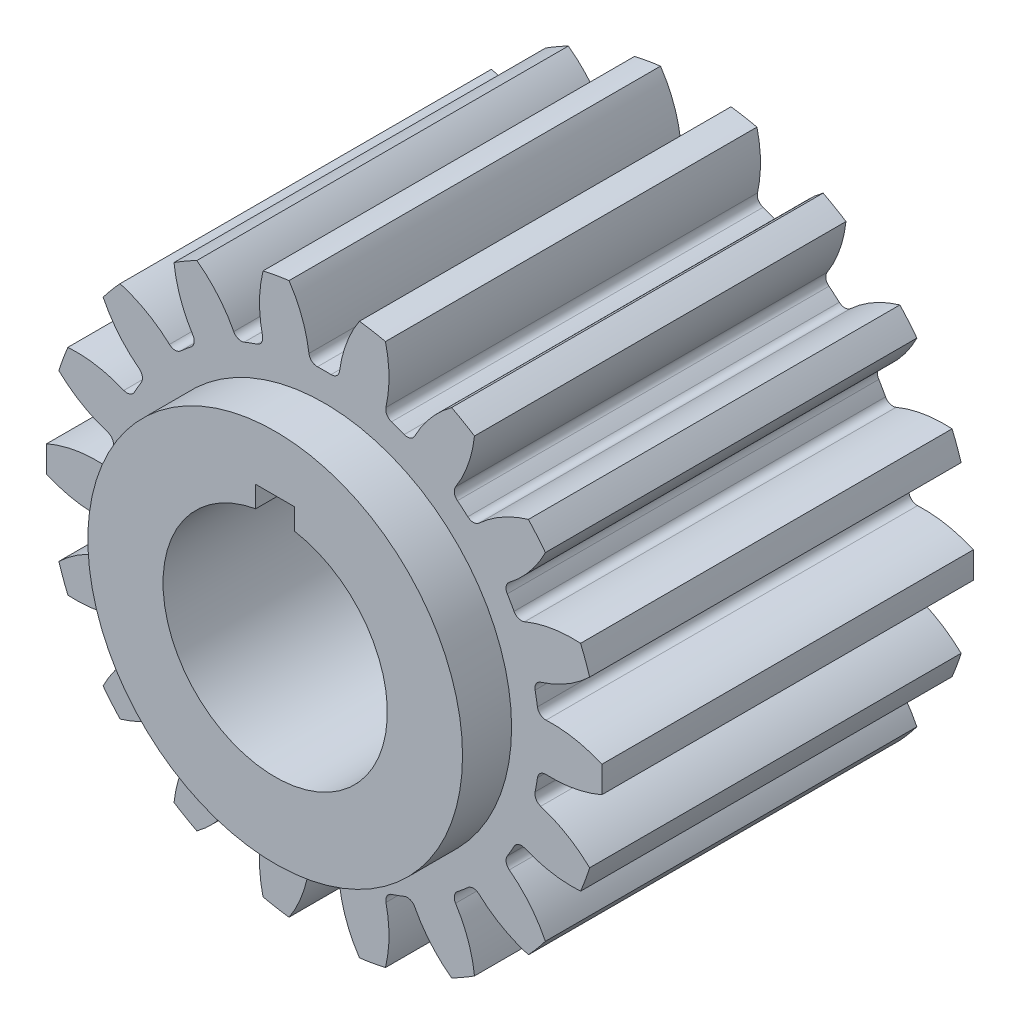
from build123d import *

# Parameters (mm, degrees)
SKETCH1_R                = 19.824032773
BOSS_EXTRUDE1_DEPTH      = 13.25
CUT_EXTRUDE1_DEPTH       = 39.577643147
FILLET1_R                = 0.594720983
CIRPATTERN2_COUNT        = 18
FILLET1_OF_CIRPATTERN2_R = 0.594720983
CUT_EXTRUDE2_DEPTH       = 39.495823844
BOSS_EXTRUDE3_START      = 3.5
SKETCH4_R                = 13.363625399
BOSS_EXTRUDE3_DEPTH      = 3.5


with BuildPart() as part:
    # Sketch1 → Boss-Extrude1 (new, symmetric)
    with BuildSketch(Plane.XY):
        Circle(SKETCH1_R)
    extrude(amount=BOSS_EXTRUDE1_DEPTH, both=True)

    # Sketch2 → Cut-Extrude1 (cut, through all)
    with BuildSketch(Plane.XY.offset(13.25)):
        with BuildLine():
            ThreePointArc((-3.206596484, 20.57566718), (-1.693168203, 18.129454416), (-1.03805801, 15.328516594))
            ThreePointArc((-1.03805801, 15.328516594), (0, 15.363625399), (1.03805801, 15.328516594))
            ThreePointArc((1.03805801, 15.328516594), (1.693168203, 18.129454416), (3.206596484, 20.57566718))
            ThreePointArc((3.206596484, 20.57566718), (0, 20.824032773), (-3.206596484, 20.57566718))
        make_face()
    cut_extrude1 = extrude(amount=-CUT_EXTRUDE1_DEPTH, mode=Mode.SUBTRACT)

    # Fillet1
    fillet1_edges = [part.edges().sort_by_distance(p)[0] for p in [
        (-1.03805801, 15.328516594, 0),
        (1.03805801, 15.328516594, 0),
    ]]
    fillet(fillet1_edges, radius=FILLET1_R)

    # CirPattern2: Cut-Extrude1 ×18 about axis
    cirpattern2_axis = Axis((0, 0, 0), (0, 0, 1))
    for i in range(1, CIRPATTERN2_COUNT):
        add(cut_extrude1.rotate(cirpattern2_axis, i * 360 / CIRPATTERN2_COUNT), mode=Mode.SUBTRACT)

    # Fillet1 of CirPattern2
    fillet1_of_cirpattern2_edges = [part.edges().sort_by_distance(p)[0] for p in [
        (-6.218116894, 14.049057182, 0),
        (-4.267205991, 14.75913068, 0),
        (-10.648179112, 11.075074131, 0),
        (-9.057781971, 12.409575785, 0),
        (-13.793913778, 6.76527369, 0),
        (-12.755855768, 8.563242904, 0),
        (-15.275898866, 1.639481397, 0),
        (-14.915385102, 3.684056549, 0),
        (-14.915385102, -3.684056549, 0),
        (-15.275898866, -1.639481397, 0),
        (-12.755855768, -8.563242904, 0),
        (-13.793913778, -6.76527369, 0),
        (-9.057781971, -12.409575785, 0),
        (-10.648179112, -11.075074131, 0),
        (-4.267205991, -14.75913068, 0),
        (-6.218116894, -14.049057182, 0),
        (1.03805801, -15.328516594, 0),
        (-1.03805801, -15.328516594, 0),
        (6.218116894, -14.049057182, 0),
        (4.267205991, -14.75913068, 0),
        (10.648179112, -11.075074131, 0),
        (9.057781971, -12.409575785, 0),
        (13.793913778, -6.76527369, 0),
        (12.755855768, -8.563242904, 0),
        (15.275898866, -1.639481397, 0),
        (14.915385102, -3.684056549, 0),
        (14.915385102, 3.684056549, 0),
        (15.275898866, 1.639481397, 0),
        (12.755855768, 8.563242904, 0),
        (13.793913778, 6.76527369, 0),
        (9.057781971, 12.409575785, 0),
        (10.648179112, 11.075074131, 0),
        (4.267205991, 14.75913068, 0),
        (6.218116894, 14.049057182, 0),
    ]]
    fillet(fillet1_of_cirpattern2_edges, radius=FILLET1_OF_CIRPATTERN2_R)

    # Sketch3 → Cut-Extrude2 (cut, through all)
    with BuildSketch(Plane.XY.offset(13.25)):
        with BuildLine():
            Line((-1.39, 7.878318348), (-1.39, 9.39))
            Line((-1.39, 9.39), (1.39, 9.39))
            Line((1.39, 9.39), (1.39, 7.878318348))
            ThreePointArc((1.39, 7.878318348), (0, -8), (-1.39, 7.878318348))
        make_face()
    extrude(amount=-CUT_EXTRUDE2_DEPTH, mode=Mode.SUBTRACT)

    # Sketch4 → Boss-Extrude3 (add)
    with BuildSketch(Plane.XY.offset(13.25).offset(BOSS_EXTRUDE3_START)):
        Circle(SKETCH4_R)
        with BuildLine():
            Line((-1.39, 7.878318348), (-1.39, 9.39))
            Line((-1.39, 9.39), (1.39, 9.39))
            Line((1.39, 9.39), (1.39, 7.878318348))
            ThreePointArc((1.39, 7.878318348), (0, -8), (-1.39, 7.878318348))
        make_face(mode=Mode.SUBTRACT)
    extrude(amount=-BOSS_EXTRUDE3_DEPTH)


solid = part.part
